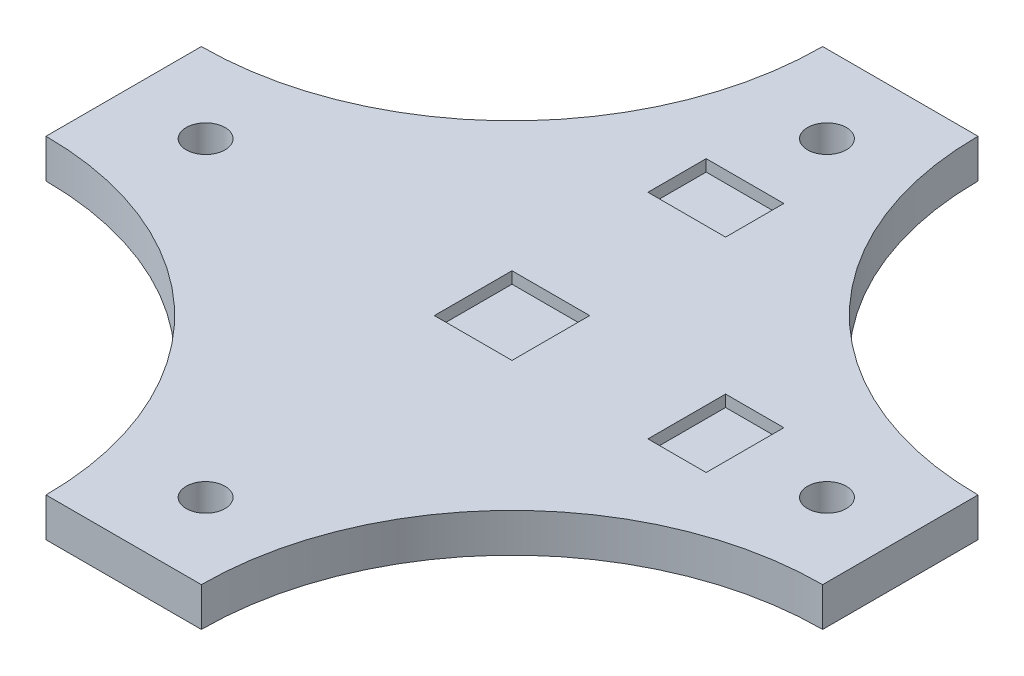
from build123d import *

# Parameters (mm, degrees)
CROQUIS1_W              = 200
CROQUIS1_H              = 200
SALIENTE_EXTRUIR1_DEPTH = 10
CROQUIS2_W              = 20
CROQUIS2_H              = 20
CROQUIS2_H_2            = 15
CROQUIS2_W_2            = 15
CORTAR_EXTRUIR1_DEPTH   = 3
CORTAR_EXTRUIR2_DEPTH   = 10
CROQUIS4_R              = 5
CORTAR_EXTRUIR3_DEPTH   = 10


with BuildPart() as part:
    # Croquis1 → Saliente-Extruir1 (new body)
    with BuildSketch(Plane(origin=(0, 0, 0), x_dir=(1, 0, 0), z_dir=(0, 1, 0))):
        Rectangle(CROQUIS1_W, CROQUIS1_H)
    extrude(amount=SALIENTE_EXTRUIR1_DEPTH)

    # Croquis2 → Cortar-Extruir1 (cut)
    with BuildSketch(Plane(origin=(0, 10, 0), x_dir=(1, 0, 0), z_dir=(0, 1, 0))):
        Rectangle(CROQUIS2_W, CROQUIS2_H)
        with Locations((0, 52.5)):
            Rectangle(CROQUIS2_W, CROQUIS2_H_2)
        with Locations((52.5, 0)):
            Rectangle(CROQUIS2_W_2, CROQUIS2_H)
    extrude(amount=-CORTAR_EXTRUIR1_DEPTH, mode=Mode.SUBTRACT)

    # Croquis3 → Cortar-Extruir2 (cut)
    with BuildSketch(Plane(origin=(0, 10, 0), x_dir=(1, 0, 0), z_dir=(0, 1, 0))):
        with BuildLine():
            Line((100, 100), (20, 100))
            ThreePointArc((20, 100), (43.431457505, 43.431457505), (100, 20))
            Line((100, 20), (100, 100))
        make_face()
        with BuildLine():
            ThreePointArc((-100, 20), (-43.431457505, 43.431457505), (-20, 100))
            Line((-20, 100), (-100, 100))
            Line((-100, 100), (-100, 20))
        make_face()
        with BuildLine():
            ThreePointArc((-20, -100), (-43.431457505, -43.431457505), (-100, -20))
            Line((-100, -20), (-100, -100))
            Line((-100, -100), (-20, -100))
        make_face()
        with BuildLine():
            Line((100, -100), (100, -20))
            ThreePointArc((100, -20), (43.431457505, -43.431457505), (20, -100))
            Line((20, -100), (100, -100))
        make_face()
    extrude(amount=-CORTAR_EXTRUIR2_DEPTH, mode=Mode.SUBTRACT)

    # Croquis4 → Cortar-Extruir3 (cut)
    with BuildSketch(Plane(origin=(0, 10, 0), x_dir=(1, 0, 0), z_dir=(0, 1, 0))):
        with Locations(Location((-78.897440542, 0, 0), (0, 0, 270))):
            Circle(CROQUIS4_R)
        with Locations(Location((1.102559458, 80, 0), (0, 0, 270))):
            Circle(CROQUIS4_R)
        with Locations(Location((81.102559458, 0, 0), (0, 0, 270))):
            Circle(CROQUIS4_R)
        with Locations(Location((1.102559458, -80, 0), (0, 0, 270))):
            Circle(CROQUIS4_R)
    extrude(amount=-CORTAR_EXTRUIR3_DEPTH, mode=Mode.SUBTRACT)


solid = part.part
